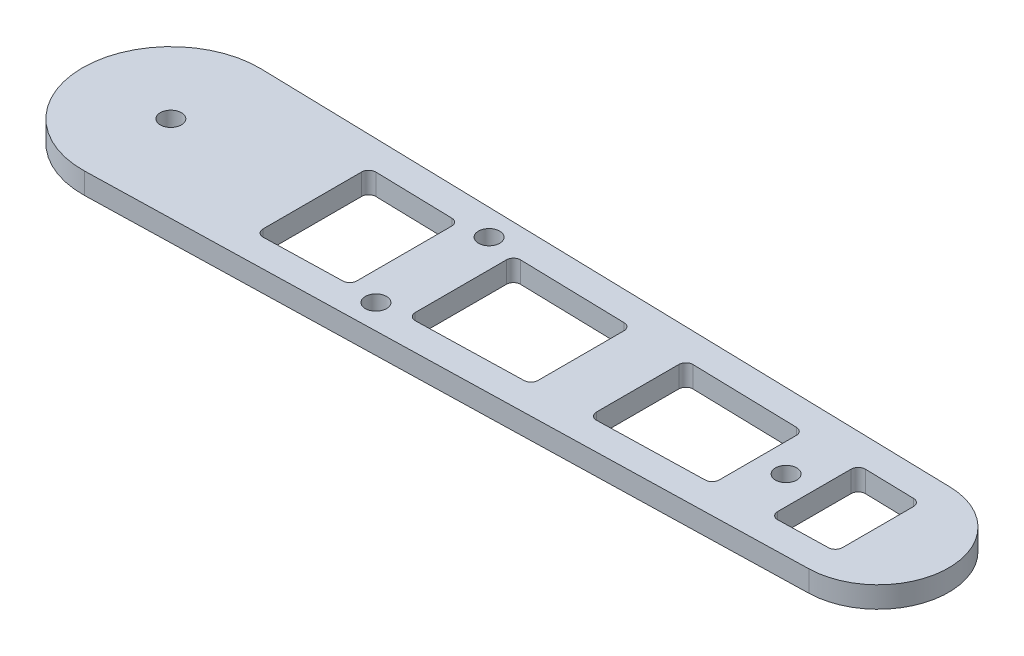
from build123d import *

# Parameters (mm, degrees)
EXTRUDE_1_DEPTH     = 3
SKETCH_2_R          = 4.5
SKETCH_2_R_2        = 3
EXTRUDE_2_DEPTH     = 1.5
CUT_EXTRUDE_1_DEPTH = 3
FILLET_1_R          = 1


with BuildPart() as part:
    # 草图1 → 凸台-拉伸1 (new body)
    with BuildSketch(Plane(origin=(0, 0, 0), x_dir=(1, 0, 0), z_dir=(0, 1, 0))):
        with BuildLine():
            ThreePointArc((-1.5, 0), (0, 1.5), (1.5, 0))
            Line((1.5, 0), (12.5, 0))
            ThreePointArc((12.5, 0), (8.948638165, 8.727650027), (0.3125, 12.496093139))
            ThreePointArc((0.3125, 12.496093139), (-8.727650027, 8.948638165), (-12.5, 0))
            Line((-12.5, 0), (-1.5, 0))
        make_face()
        with BuildLine():
            Line((12.5, 0), (1.5, 0))
            ThreePointArc((1.5, 0), (0, -1.5), (-1.5, 0))
            Line((-1.5, 0), (-12.5, 0))
            ThreePointArc((-12.5, 0), (-8.727650027, -8.948638165), (0.3125, -12.496093139))
            ThreePointArc((0.3125, -12.496093139), (8.948638165, -8.727650027), (12.5, 0))
        make_face()
        with BuildLine():
            ThreePointArc((0.3125, 12.496093139), (8.948638165, 8.727650027), (12.5, 0))
            Line((12.5, 0), (90, 0))
            ThreePointArc((90, 0), (93.017879978, 7.158910532), (100.25, 9.996874512))
            Line((100.25, 9.996874512), (0.3125, 12.496093139))
        make_face()
        with BuildLine():
            Line((90, 0), (12.5, 0))
            ThreePointArc((12.5, 0), (8.948638165, -8.727650027), (0.3125, -12.496093139))
            Line((0.3125, -12.496093139), (100.25, -9.996874512))
            ThreePointArc((100.25, -9.996874512), (93.017879978, -7.158910532), (90, 0))
        make_face()
        with BuildLine():
            ThreePointArc((100.25, 9.996874512), (93.017879978, 7.158910532), (90, 0))
            Line((90, 0), (110, 0))
            ThreePointArc((110, 0), (107.158910532, 6.982120022), (100.25, 9.996874512))
        make_face()
        with BuildLine():
            Line((110, 0), (90, 0))
            ThreePointArc((90, 0), (93.017879978, -7.158910532), (100.25, -9.996874512))
            ThreePointArc((100.25, -9.996874512), (107.158910532, -6.982120022), (110, 0))
        make_face()
    extrude(amount=EXTRUDE_1_DEPTH)

    # 草图2 → 凸台-拉伸2 (add)
    with BuildSketch(Plane.XZ):
        with Locations(Location((0, 0, 0), (0, 0, 90))):
            Circle(SKETCH_2_R)
        with Locations(Location((0, 0, 0), (0, 0, 270))):
            Circle(SKETCH_2_R_2, mode=Mode.SUBTRACT)
    extrude(amount=EXTRUDE_2_DEPTH)

    # 草图3 → 切除-拉伸1 (cut)
    with BuildSketch(Plane(origin=(0, 3, 0), x_dir=(1, 0, 0), z_dir=(0, 1, 0))):
        Polygon((20, 8.002501172), (20, 0), (33, 0), (33, 7.677399562), align=None)
        Polygon((33, 0), (20, 0), (20, -8.002501172), (33, -7.677399562), align=None)
        with BuildLine():
            ThreePointArc((38.5, 8), (36.805156295, 9.487291475), (35.550618759, 7.613614157))
            Line((35.550618759, 7.613614157), (38.42825626, 7.541650728))
            ThreePointArc((38.42825626, 7.541650728), (38.481955531, 7.768034906), (38.5, 8))
        make_face()
        with BuildLine():
            Line((38.42825626, 7.541650728), (35.550618759, 7.613614157))
            ThreePointArc((35.550618759, 7.613614157), (36.9625, 6.500468823), (38.42825626, 7.541650728))
        make_face()
        with BuildLine():
            ThreePointArc((38.42825626, -7.541650728), (36.9625, -6.500468823), (35.550618759, -7.613614157))
            Line((35.550618759, -7.613614157), (38.42825626, -7.541650728))
        make_face()
        with BuildLine():
            Line((38.42825626, -7.541650728), (35.550618759, -7.613614157))
            ThreePointArc((35.550618759, -7.613614157), (36.805156295, -9.487291475), (38.5, -8))
            ThreePointArc((38.5, -8), (38.481955531, -7.768034906), (38.42825626, -7.541650728))
        make_face()
        Polygon((41, 7.477337033), (41, 0), (58, 0), (58, 7.052204158), align=None)
        Polygon((58, 0), (41, 0), (41, -7.477337033), (58, -7.052204158), align=None)
        Polygon((66, 6.852141629), (66, 0), (83, 0), (83, 6.427008754), align=None)
        Polygon((83, 0), (66, 0), (66, -6.852141629), (83, -6.427008754), align=None)
        with BuildLine():
            ThreePointArc((88.5, 0), (87, 1.5), (85.5, 0))
            Line((85.5, 0), (88.5, 0))
        make_face()
        with BuildLine():
            Line((88.5, 0), (85.5, 0))
            ThreePointArc((85.5, 0), (87, -1.5), (88.5, 0))
        make_face()
        Polygon((100, 6.001875879), (91, 6.226946225), (91, 0), (100, 0), align=None)
        Polygon((91, 0), (91, -6.226946225), (100, -6.001875879), (100, 0), align=None)
    extrude(amount=-CUT_EXTRUDE_1_DEPTH, mode=Mode.SUBTRACT)

    # 圆角1
    fillet_1_edges = [part.edges().sort_by_distance(p)[0] for p in [
        (20, 1.5, 8.002501172),
        (20, 1.5, -8.002501172),
        (33, 1.5, -7.677399562),
        (33, 1.5, 7.677399562),
        (41, 1.5, 7.477337033),
        (41, 1.5, -7.477337033),
        (58, 1.5, -7.052204158),
        (58, 1.5, 7.052204158),
        (66, 1.5, 6.852141629),
        (66, 1.5, -6.852141629),
        (83, 1.5, -6.427008754),
        (83, 1.5, 6.427008754),
        (91, 1.5, 6.226946225),
        (91, 1.5, -6.226946225),
        (100, 1.5, -6.001875879),
        (100, 1.5, 6.001875879),
    ]]
    fillet(fillet_1_edges, radius=FILLET_1_R)


solid = part.part
